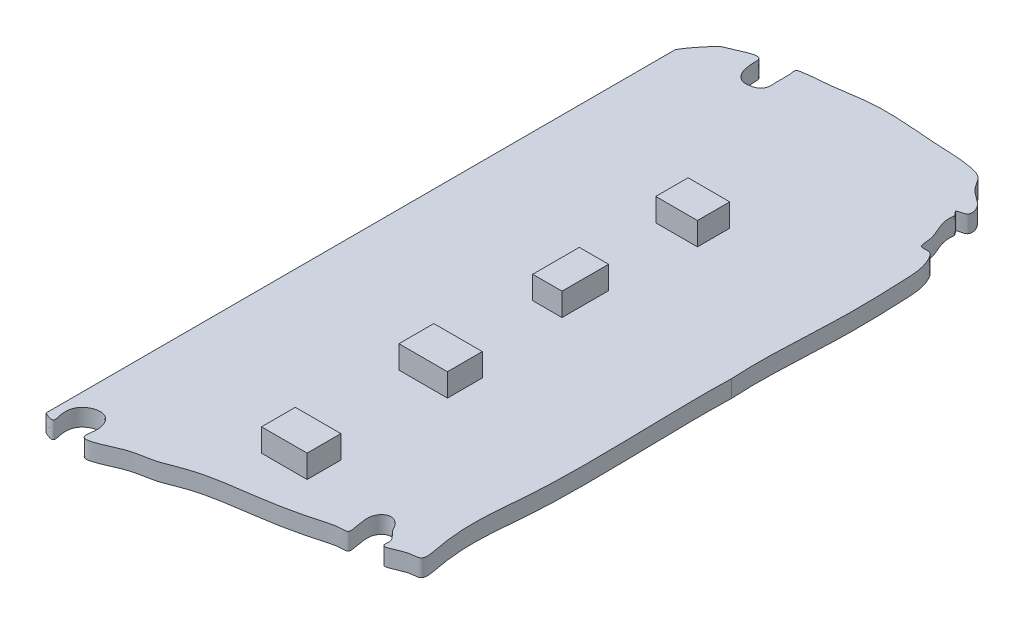
from build123d import *

# Parameters (mm, degrees)
EXTRUDE_1_DEPTH = 1.5
SKETCH_2_W      = 3.641360828
SKETCH_2_H      = 2.823912479
SKETCH_2_W_2    = 2.560260108
SKETCH_2_H_2    = 4.070365954
SKETCH_2_W_3    = 4.235868718
SKETCH_2_H_3    = 3.046852937
SKETCH_2_W_4    = 3.980824833
SKETCH_2_H_4    = 2.953515199
EXTRUDE_2_DEPTH = 2
SKETCH_3_R      = 4.954752346
SKETCH_3_W      = 10.727391442
SKETCH_3_H      = 3.423635567
SKETCH_3_W_2    = 3.423635567
SKETCH_3_H_2    = 13.922784638
EXTRUDE_3_DEPTH = 2


with BuildPart() as part:
    # 草图1 → 凸台-拉伸1 (new body)
    with BuildSketch(Plane(origin=(0, 0, 0), x_dir=(1, 0, 0), z_dir=(0, 1, 0))):
        with BuildLine():
            Line((0, 17.662865505), (0, 72.662865505))
            add(Edge.make_bspline(
                [(0, 72.662865505), (0.359994338, 73.317840741), (0.961790835, 74.013712658), (1.651769448, 74.865970817), (2.2237125, 75.078394076), (2.963796752, 75.385508549), (4.447892556, 76.095370782), (4.404920424, 75.020607647), (4.470972621, 74.414798052), (4.668868176, 73.678159547), (5.28307957, 73.113571144), (5.965522322, 73.174926274), (6.52743516, 73.30902678), (6.958590181, 73.839871323), (6.846769074, 74.620864446), (6.88369291, 75.362906626), (6.879169739, 75.929624199), (6.761352631, 76.400426411), (7.34342991, 76.510080151), (8.170824777, 76.631944856), (9.926067545, 76.722931376), (12.415303356, 77.252469909), (15.561754789, 77.192413629), (18.880688136, 76.852349303), (21.283671306, 76.855338978), (23.078936939, 76.29196178), (23.623214072, 74.763426633), (25.225191797, 74.31799166), (25.400306471, 72.79166722), (24.224528566, 72.801354171), (24.81763691, 72.387567236), (24.648550622, 71.563119879), (25.116725802, 70.462671395), (25.542685225, 69.482122183), (25.520423138, 68.308543736), (26.44415621, 68.613158726), (27.358373207, 67.30903347), (27.465803045, 64.557619954), (27.677449576, 58.62456891), (27.144942804, 53.652510599), (27.362010621, 50.210209417)],
                knots=[0, 0, 0, 0, 0.038765253, 0.048891498, 0.056214385, 0.069512153, 0.097007191, 0.106269992, 0.116550062, 0.130621982, 0.145160196, 0.155389249, 0.16509338, 0.174918064, 0.187714604, 0.20459254, 0.213302264, 0.219439696, 0.224948209, 0.238908149, 0.267154043, 0.314168752, 0.372988026, 0.430416663, 0.489044393, 0.498922184, 0.525840339, 0.56381548, 0.575678535, 0.588505701, 0.593942517, 0.602697176, 0.629615331, 0.653080919, 0.664121664, 0.67750766, 0.687633905, 0.740395392, 0.819448255, 1, 1, 1, 1], degree=3))
            add(Edge.make_bspline(
                [(27.362010621, 50.210209417), (27.187485216, 44.627176414), (27.966035151, 34.897021733), (26.683035445, 27.305447808), (27.695649126, 22.881168036), (26.187229842, 23.042925819), (24.601165607, 21.912960837), (24.85897088, 23.281126598), (24.039352108, 23.726410022), (23.716808759, 24.6475316), (22.794066332, 25.080179717), (21.758444387, 24.085790322), (22.122672509, 23.021923082), (22.290109674, 21.743482837), (21.467331231, 21.881840034), (18.340812215, 20.969829219), (15.485923515, 20.50240584), (11.07268025, 19.931645067), (8.250046685, 18.646585046), (6.319905319, 18.630002489), (3.125608368, 16.717439113), (3.54342278, 18.550258459), (3.436444353, 19.375453599), (2.793221384, 20.19086256), (1.654198332, 20.163010596), (0.67331743, 19.296393441), (0.745216148, 17.991314038), (1.068786026, 17.150537029), (0, 17.662865505)],
                knots=[0, 0, 0, 0, 0.284862499, 0.411162803, 0.432641934, 0.448072643, 0.475377821, 0.482251143, 0.502279339, 0.512331371, 0.528882737, 0.539744887, 0.572393166, 0.579266488, 0.591998026, 0.603783111, 0.697117333, 0.775565699, 0.802816917, 0.839091763, 0.884645069, 0.897259758, 0.912555473, 0.925130102, 0.942298667, 0.960054774, 0.981327496, 1, 1, 1, 1], degree=3))
        make_face()
    extrude(amount=EXTRUDE_1_DEPTH)

    # 草图2 → 凸台-拉伸2 (add)
    with BuildSketch(Plane(origin=(0, 1.5, 0), x_dir=(1, 0, 0), z_dir=(0, 1, 0))):
        with Locations((14.077214113, 60.111951137)):
            Rectangle(SKETCH_2_W, SKETCH_2_H)
        with Locations((14.05064076, 49.468781143)):
            Rectangle(SKETCH_2_W_2, SKETCH_2_H_2)
        with Locations((14.301042771, 37.852692672)):
            Rectangle(SKETCH_2_W_3, SKETCH_2_H_3)
        with Locations((14.45824736, 25.51129467)):
            Rectangle(SKETCH_2_W_4, SKETCH_2_H_4)
    extrude(amount=EXTRUDE_2_DEPTH)

    # 草图3 → 凸台-拉伸3 (add)
    with BuildSketch(Plane(origin=(0, 0, 0), x_dir=(-1, 0, 0), z_dir=(0, -1, 0))):
        with Locations(Location((-8.526857342, 54.167726659, 0), (0, 0, 90))):
            Circle(SKETCH_3_R)
        with Locations((-6.472676002, 66.835178256)):
            Rectangle(SKETCH_3_W, SKETCH_3_H)
        with Locations((-15.031764919, 65.237481658)):
            Rectangle(SKETCH_3_W_2, SKETCH_3_H_2)
    extrude(amount=EXTRUDE_3_DEPTH)


solid = part.part
